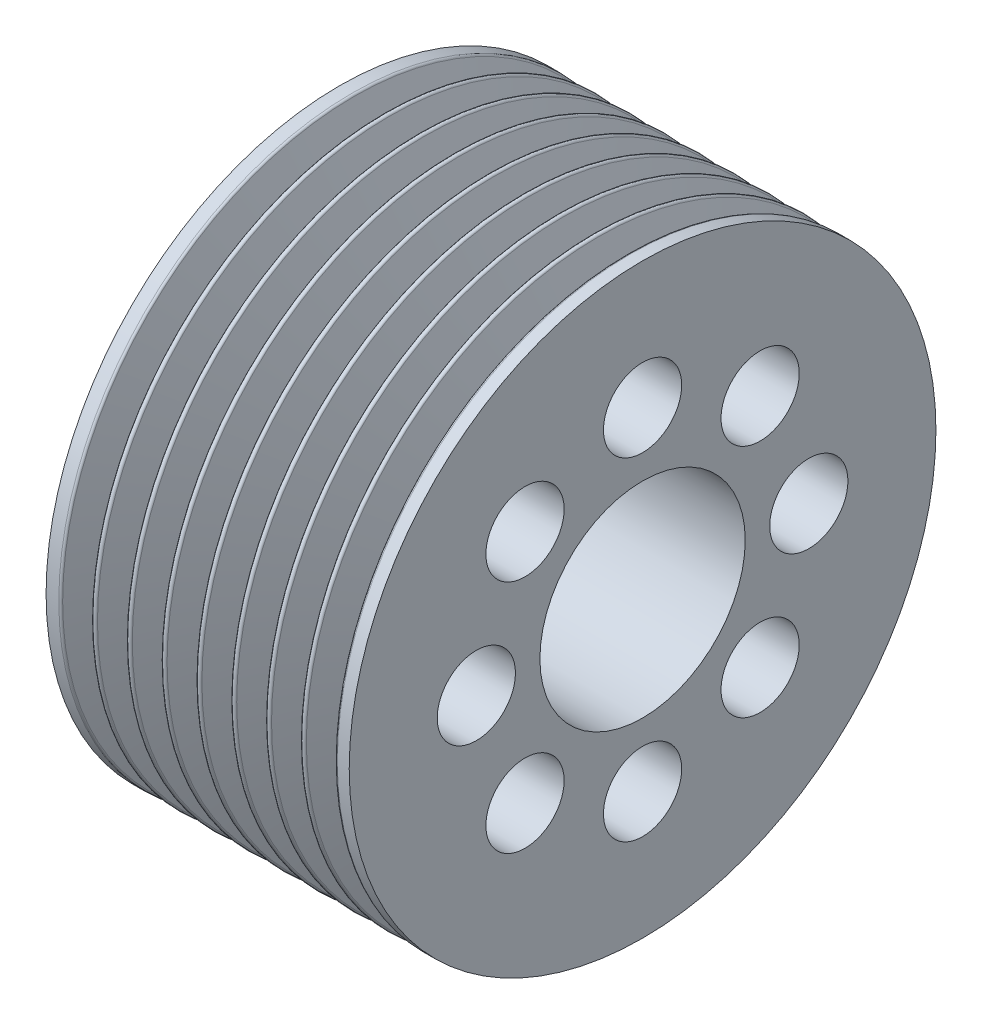
from build123d import *

# Parameters (mm, degrees)
LPATTERN1_COUNT    = 8
LPATTERN1_PITCH    = 3.56
SKETCH3_R          = 4
CUT_EXTRUDE1_DEPTH = 17.5


with BuildPart() as part:
    # Sketch1 → Revolve1 (revolve)
    with BuildSketch(Plane.XY, mode=Mode.PRIVATE) as revolve1_sk:
        Polygon((49, 10.5), (49, 30), (18, 30), (18, 21.5), (31.5, 21.5), (31.5, 10.5), align=None)
    revolve(revolve1_sk.sketch.rotate(Axis((0, 0, 0), (1, 0, 0)), 90), axis=Axis((0, 0, 0), (1, 0, 0)))

    # Sketch2 → Cut-Revolve1 (revolve, cut)
    with BuildSketch(Plane.XY, mode=Mode.PRIVATE) as cut_revolve1_sk:
        with BuildLine():
            Line((47.545831953, 29.837551845), (46.281001657, 26.45460955))
            ThreePointArc((46.281001657, 26.45460955), (46, 26.259671764), (45.718998343, 26.45460955))
            Line((45.718998343, 26.45460955), (44.454168047, 29.837551845))
            ThreePointArc((44.454168047, 29.837551845), (44.362499191, 29.955411734), (44.22, 30))
            Line((44.22, 30), (47.78, 30))
            ThreePointArc((47.78, 30), (47.637500809, 29.955411734), (47.545831953, 29.837551845))
        make_face()
    cut_revolve1 = revolve(cut_revolve1_sk.sketch.rotate(Axis((0, 0, 0), (1, 0, 0)), 90), axis=Axis((0, 0, 0), (1, 0, 0)), mode=Mode.SUBTRACT)

    # LPattern1: Cut-Revolve1 ×8
    with Locations(*[(-i * LPATTERN1_PITCH, 0, 0) for i in range(1, LPATTERN1_COUNT)]):
        add(cut_revolve1, mode=Mode.SUBTRACT)

    # Sketch3 → Cut-Extrude1 (cut)
    with BuildSketch(Plane(origin=(49, 0, 0), x_dir=(0, 0, -1), z_dir=(1, 0, 0))):
        with Locations((0, 17)):
            Circle(SKETCH3_R)
        with Locations((12.02081528, 12.02081528)):
            Circle(SKETCH3_R)
        with Locations((17, 0)):
            Circle(SKETCH3_R)
        with Locations((12.02081528, -12.02081528)):
            Circle(SKETCH3_R)
        with Locations((0, -17)):
            Circle(SKETCH3_R)
        with Locations((-12.02081528, -12.02081528)):
            Circle(SKETCH3_R)
        with Locations((-17, 0)):
            Circle(SKETCH3_R)
        with Locations((-12.02081528, 12.02081528)):
            Circle(SKETCH3_R)
    extrude(amount=-CUT_EXTRUDE1_DEPTH, mode=Mode.SUBTRACT)


solid = part.part
